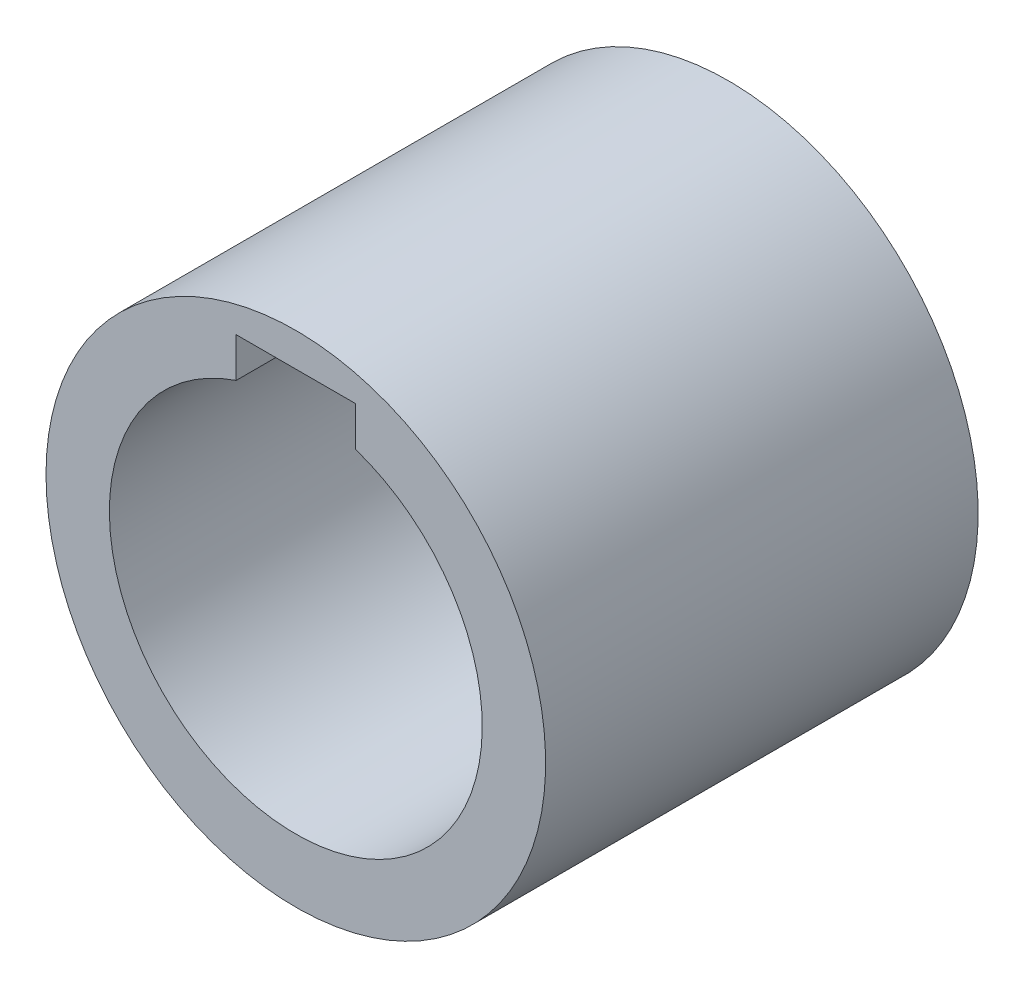
from build123d import *

# Parameters (mm, degrees)
SKETCH1_R           = 16.75
SKETCH1_R_2         = 12.5
BOSS_EXTRUDE1_DEPTH = 29
SKETCH2_W           = 8
SKETCH2_H           = 4
CUT_EXTRUDE2_DEPTH  = 25.5
FILLET1_R           = 2.5
FILLET2_R           = 2.5


with BuildPart() as part:
    # Sketch1 → Boss-Extrude1 (new body)
    with BuildSketch(Plane.XY):
        with Locations(Location((0, 0, 0), (0, 0, 180))):
            Circle(SKETCH1_R)
        with Locations(Location((0, 0, 0), (0, 0, 180))):
            Circle(SKETCH1_R_2, mode=Mode.SUBTRACT)
    extrude(amount=BOSS_EXTRUDE1_DEPTH)

    # Sketch2 → Cut-Extrude2 (cut)
    with BuildSketch(Plane.XY.offset(29)):
        with Locations((0, 12.5)):
            Rectangle(SKETCH2_W, SKETCH2_H)
    extrude(amount=-CUT_EXTRUDE2_DEPTH, mode=Mode.SUBTRACT)

    # Fillet1
    fillet1_edges = [part.edges().sort_by_distance(p)[0] for p in [
        (4, 13.171359641, 3.5),
    ]]
    fillet(fillet1_edges, radius=FILLET1_R)

    # Fillet2
    fillet2_edges = [part.edges().sort_by_distance(p)[0] for p in [
        (-4, 13.171359641, 3.5),
    ]]
    fillet(fillet2_edges, radius=FILLET2_R)


solid = part.part
